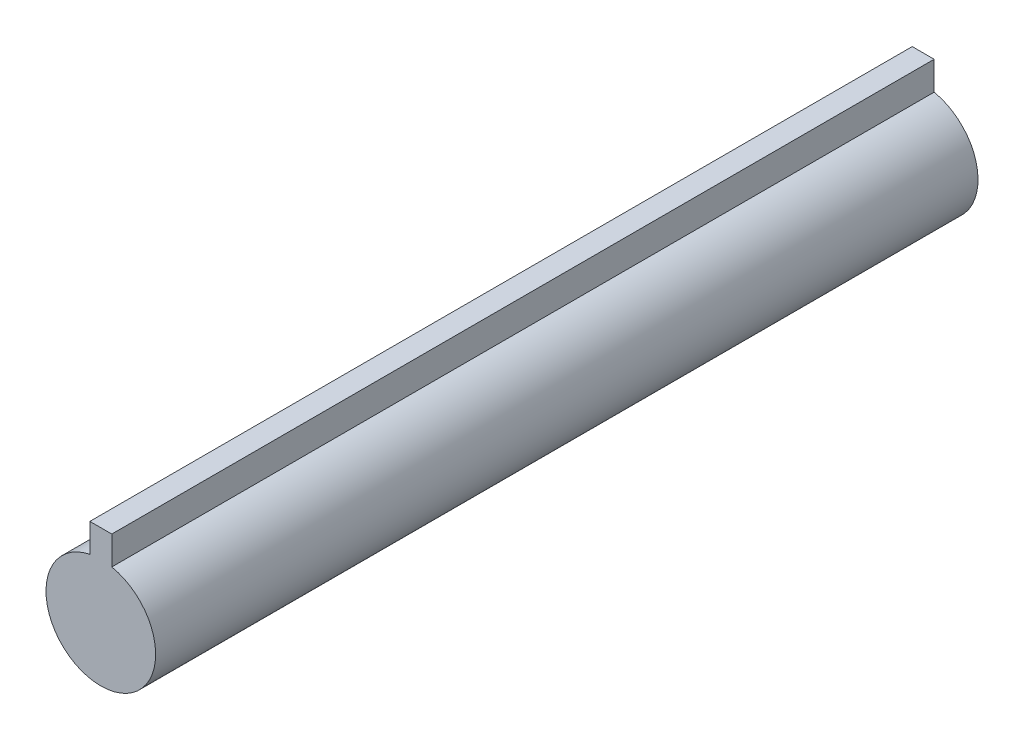
from build123d import *

# Parameters (mm, degrees)
EXTRUDE_1_DEPTH = 15


with BuildPart() as part:
    # 草图1 → 凸台-拉伸1 (new body)
    with BuildSketch(Plane.XY):
        with BuildLine():
            Line((0, 1.5), (0.2, 1.5))
            Line((0.2, 1.5), (0.2, 0.979795897))
            ThreePointArc((0.2, 0.979795897), (0, -1), (-0.2, 0.979795897))
            Line((-0.2, 0.979795897), (-0.2, 1.5))
            Line((-0.2, 1.5), (0, 1.5))
        make_face()
    extrude(amount=EXTRUDE_1_DEPTH)


solid = part.part
